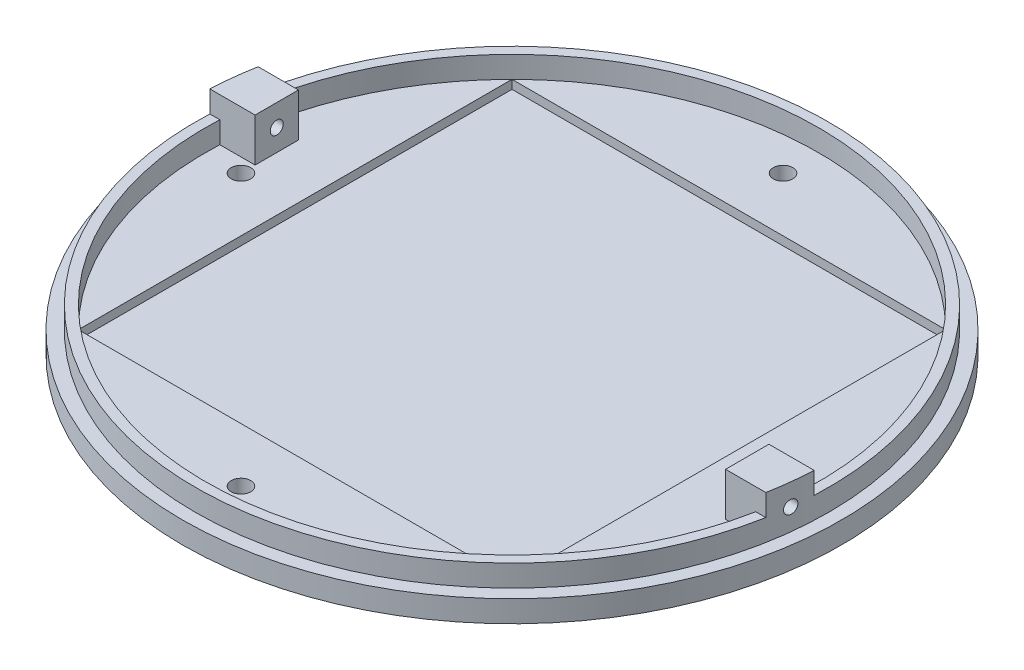
from build123d import *

# Parameters (mm, degrees)
SKETCH1_R           = 76
SKETCH1_W           = 100
SKETCH1_H           = 100
BOSS_EXTRUDE1_DEPTH = 5
SKETCH3_W           = 100
SKETCH3_H           = 100
BOSS_EXTRUDE2_DEPTH = 5
SKETCH3_2_W         = 100
SKETCH3_2_H         = 100
CUT_EXTRUDE1_DEPTH  = 2
SKETCH6_R           = 2.25
CUT_EXTRUDE2_DEPTH  = 10
SKETCH8_R           = 73
SKETCH8_R_2         = 70.710678119
BOSS_EXTRUDE3_DEPTH = 5
BOSS_EXTRUDE4_DEPTH = 10
BOSS_EXTRUDE5_DEPTH = 5
BOSS_EXTRUDE7_DEPTH = 10
BOSS_EXTRUDE8_DEPTH = 5
SKETCH17_R          = 1.5
CUT_EXTRUDE3_DEPTH  = 27
SKETCH18_R          = 1.5
CUT_EXTRUDE4_DEPTH  = 27


with BuildPart() as part:
    # Sketch1 → Boss-Extrude1 (new body)
    with BuildSketch(Plane(origin=(0, 0, 0), x_dir=(1, 0, 0), z_dir=(0, 1, 0))):
        Circle(SKETCH1_R)
        Rectangle(SKETCH1_W, SKETCH1_H, mode=Mode.SUBTRACT)
    extrude(amount=BOSS_EXTRUDE1_DEPTH)

    # Sketch3 → Boss-Extrude2 (add)
    with BuildSketch(Plane(origin=(0, 5, 0), x_dir=(1, 0, 0), z_dir=(0, 1, 0))):
        Rectangle(SKETCH3_W, SKETCH3_H)
    extrude(amount=-BOSS_EXTRUDE2_DEPTH)

    # Sketch3<2> → Cut-Extrude1 (cut)
    with BuildSketch(Plane(origin=(0, 5, 0), x_dir=(1, 0, 0), z_dir=(0, 1, 0))):
        Rectangle(SKETCH3_2_W, SKETCH3_2_H)
    extrude(amount=-CUT_EXTRUDE1_DEPTH, mode=Mode.SUBTRACT)

    # Sketch6 → Cut-Extrude2 (cut)
    with BuildSketch(Plane(origin=(0, 5, 0), x_dir=(1, 0, 0), z_dir=(0, 1, 0))):
        with Locations((0, 62.5)):
            Circle(SKETCH6_R)
        with Locations((62.5, 0)):
            Circle(SKETCH6_R)
        with Locations((0, -62.5)):
            Circle(SKETCH6_R)
        with Locations((-62.5, 0)):
            Circle(SKETCH6_R)
    extrude(amount=-CUT_EXTRUDE2_DEPTH, mode=Mode.SUBTRACT)

    # Sketch8 → Boss-Extrude3 (add)
    with BuildSketch(Plane(origin=(0, 5, 0), x_dir=(1, 0, 0), z_dir=(0, 1, 0))):
        Circle(SKETCH8_R)
        Circle(SKETCH8_R_2, mode=Mode.SUBTRACT)
    extrude(amount=BOSS_EXTRUDE3_DEPTH)

    # Sketch11 → Boss-Extrude4 (add)
    with BuildSketch(Plane(origin=(0, 5, 0), x_dir=(1, 0, 0), z_dir=(0, 1, 0))):
        with BuildLine():
            Line((70.635950478, -3.25), (62.5, -3.25))
            Line((62.5, -3.25), (62.5, -13.25))
            Line((62.5, -13.25), (69.458170866, -13.25))
            ThreePointArc((69.458170866, -13.25), (70.225285395, -8.270990945), (70.635950478, -3.25))
        make_face()
    extrude(amount=BOSS_EXTRUDE4_DEPTH)

    # Sketch12 → Boss-Extrude5 (add)
    with BuildSketch(Plane(origin=(0, 10, 0), x_dir=(1, 0, 0), z_dir=(0, 1, 0))):
        with BuildLine():
            Line((72.927618225, -3.25), (70.635950478, -3.25))
            ThreePointArc((70.635950478, -3.25), (70.225285395, -8.270990945), (69.458170866, -13.25))
            Line((69.458170866, -13.25), (71.787446674, -13.25))
            ThreePointArc((71.787446674, -13.25), (72.530079982, -8.269673379), (72.927618225, -3.25))
        make_face()
    extrude(amount=BOSS_EXTRUDE5_DEPTH)

    # Sketch13 → Boss-Extrude7 (add)
    with BuildSketch(Plane(origin=(0, 5, 0), x_dir=(1, 0, 0), z_dir=(0, 1, 0))):
        with BuildLine():
            Line((-70.635950478, 3.25), (-62.5, 3.25))
            Line((-62.5, 3.25), (-62.5, 13.25))
            Line((-62.5, 13.25), (-69.458170866, 13.25))
            ThreePointArc((-69.458170866, 13.25), (-70.225285395, 8.270990945), (-70.635950478, 3.25))
        make_face()
    extrude(amount=BOSS_EXTRUDE7_DEPTH)

    # Sketch14 → Boss-Extrude8 (add)
    with BuildSketch(Plane(origin=(0, 10, 0), x_dir=(1, 0, 0), z_dir=(0, 1, 0))):
        with BuildLine():
            Line((-69.458170866, 13.25), (-71.787446674, 13.25))
            ThreePointArc((-71.787446674, 13.25), (-72.530079982, 8.269673379), (-72.927618225, 3.25))
            Line((-72.927618225, 3.25), (-70.635950478, 3.25))
            ThreePointArc((-70.635950478, 3.25), (-70.225285395, 8.270990945), (-69.458170866, 13.25))
        make_face()
    extrude(amount=BOSS_EXTRUDE8_DEPTH)

    # Sketch17 → Cut-Extrude3 (cut)
    with BuildSketch(Plane(origin=(-62.5, 0, 0), x_dir=(0, 0, -1), z_dir=(1, 0, 0))):
        with Locations((8.25, 10)):
            Circle(SKETCH17_R)
    extrude(amount=-CUT_EXTRUDE3_DEPTH, mode=Mode.SUBTRACT)

    # Sketch18 → Cut-Extrude4 (cut)
    with BuildSketch(Plane.ZY.offset(-62.5)):
        with Locations((8.25, 10)):
            Circle(SKETCH18_R)
    extrude(amount=-CUT_EXTRUDE4_DEPTH, mode=Mode.SUBTRACT)


solid = part.part
